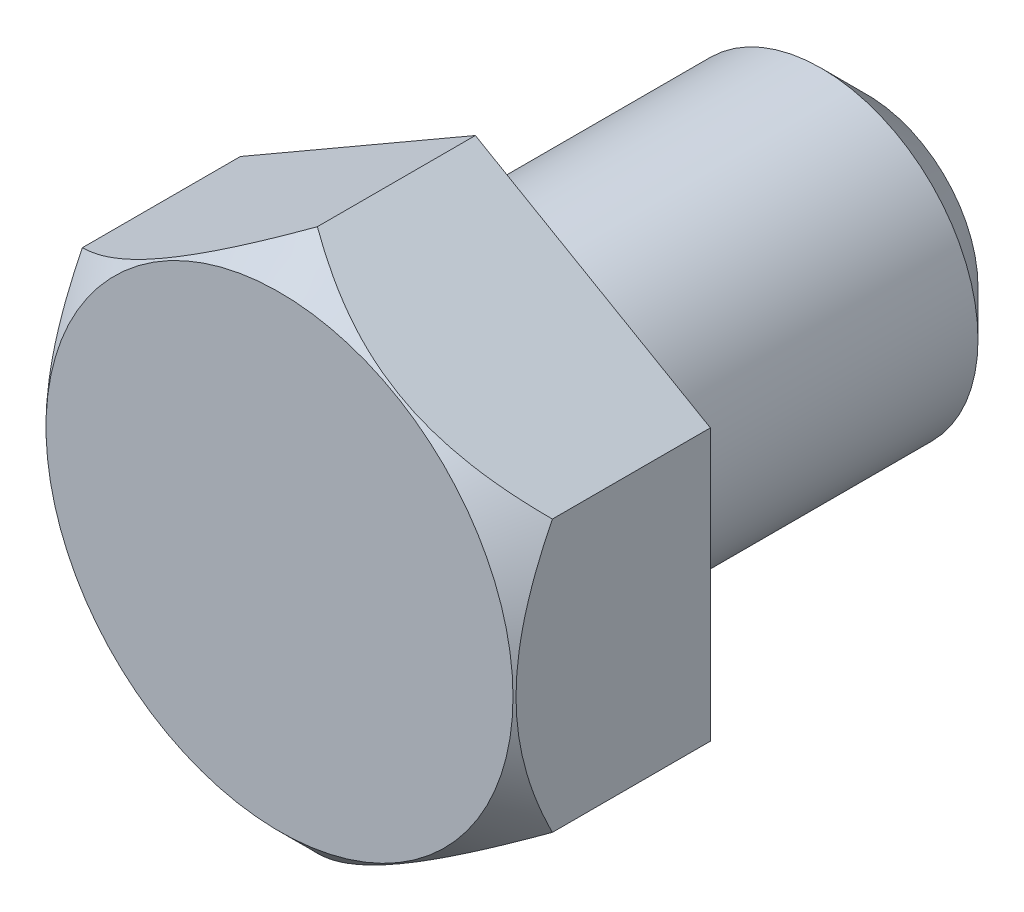
from build123d import *

# Parameters (mm, degrees)
EXTRUDE_1_DEPTH = 7.5
SKETCH_2_R      = 6
EXTRUDE_2_DEPTH = 15
CHAMFER_1_SIZE  = 1.75


with BuildPart() as part:
    # Эскиз1 → Вытянуть1 (new body)
    with BuildSketch(Plane.XY):
        Polygon((0, 10.392304845), (-9, 5.196152423), (-9, -5.196152423), (0, -10.392304845), (9, -5.196152423), (9, 5.196152423), align=None)
    extrude(amount=EXTRUDE_1_DEPTH)

    # Эскиз2 → Вытянуть2 (add)
    with BuildSketch(Plane(origin=(0, 0, 0), x_dir=(-1, 0, 0), z_dir=(0, 0, -1))):
        with Locations(Location((0, 0, 0), (0, 0, 180))):
            Circle(SKETCH_2_R)
    extrude(amount=EXTRUDE_2_DEPTH)

    # Эскиз15 → Вырез-Повернуть1 (revolve, cut)
    with BuildSketch(Plane(origin=(0, 0, 0), x_dir=(0, 0, -1), z_dir=(1, 0, 0)), mode=Mode.PRIVATE) as cut_revolve_1_sk:
        Polygon((-7.5, 10.392304845), (-7.5, 8.942304845), (-6.05, 10.392304845), align=None)
    revolve(cut_revolve_1_sk.sketch.rotate(Axis((0, 0, -2.534703431), (0, 0, -1)), 300.000000053), axis=Axis((0, 0, -2.534703431), (0, 0, -1)), mode=Mode.SUBTRACT)

    # Фаска1
    chamfer_1_edges = [part.edges().sort_by_distance(p)[0] for p in [
        (-6, 0, -15),
    ]]
    chamfer(chamfer_1_edges, length=CHAMFER_1_SIZE)


solid = part.part
